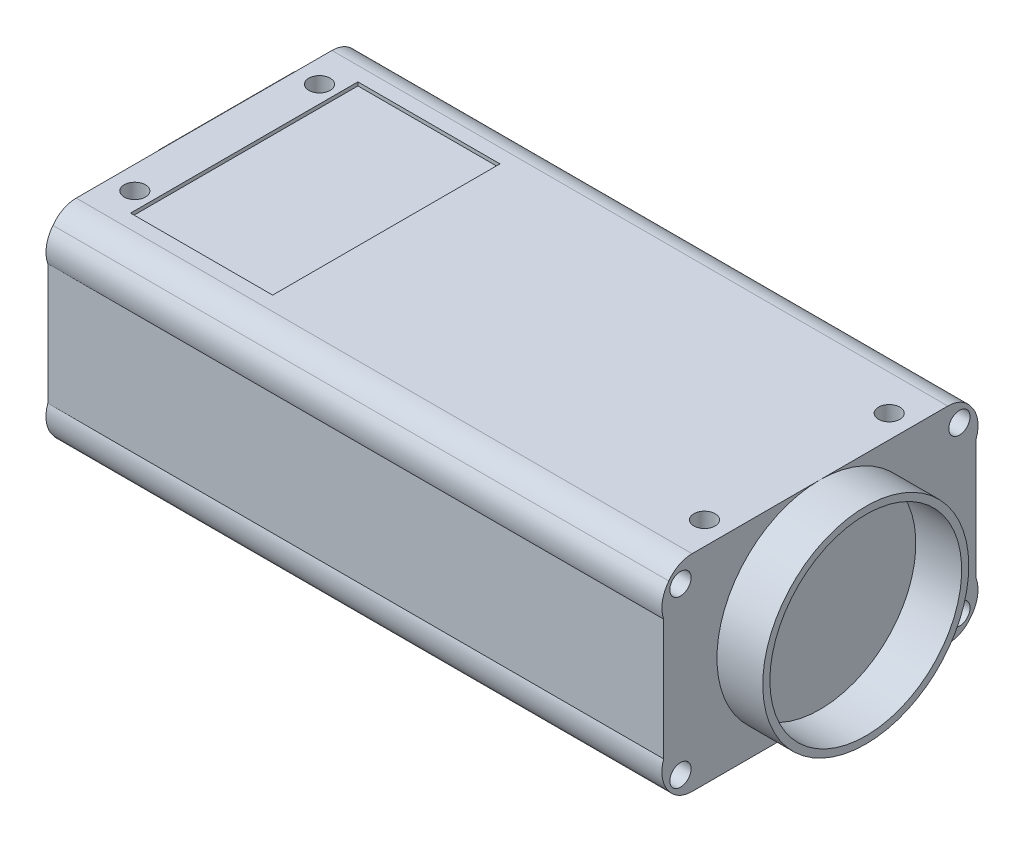
from build123d import *

# Parameters (mm, degrees)
SALIENTE_EXTRUIR2_DEPTH = 86.7
CROQUIS4_R              = 1.5
CORTAR_EXTRUIR1_DEPTH   = 4
CROQUIS5_R              = 14.5
CROQUIS5_R_2            = 13.5
SALIENTE_EXTRUIR3_DEPTH = 6.45
CROQUIS6_R              = 1.5
CORTAR_EXTRUIR2_DEPTH   = 3.5
CROQUIS8_W              = 20
CROQUIS8_H              = 32
CORTAR_EXTRUIR3_DEPTH   = 0.5
CROQUIS10_R             = 1
CORTAR_EXTRUIR6_DEPTH   = 4.5
CORTAR_EXTRUIR7_START   = -4.5
CROQUIS11_R             = 1.5
CORTAR_EXTRUIR7_DEPTH   = 4.5
CROQUIS12_W             = 19.288477202
CROQUIS12_H             = 16.6
SALIENTE_EXTRUIR4_DEPTH = 5.35
CROQUIS13_W             = 18
CROQUIS13_H             = 15.1
CORTAR_EXTRUIR8_DEPTH   = 4.35
CROQUIS14_W             = 10
CROQUIS14_H             = 5
CORTAR_EXTRUIR9_DEPTH   = 1
CROQUIS15_R             = 8
CORTAR_EXTRUIR10_DEPTH  = 3
CROQUIS16_R             = 7
CROQUIS16_R_2           = 6
SALIENTE_EXTRUIR5_DEPTH = 0.5
CROQUIS17_R             = 0.5
CORTAR_EXTRUIR12_DEPTH  = 1.5
CROQUIS18_R             = 1.5
CORTAR_EXTRUIR13_DEPTH  = 3.5


with BuildPart() as part:
    # Croquis3 → Saliente-Extruir2 (new body)
    with BuildSketch(Plane(origin=(0, 0, 0), x_dir=(0, 0, -1), z_dir=(1, 0, 0))):
        with BuildLine():
            Line((4, 0), (40, 0))
            ThreePointArc((40, 0), (41.842910618, 0.449833743), (43.271319545, 1.698159773))
            ThreePointArc((43.271319545, 1.698159773), (44.186191252, 3.744879364), (44, 5.979019946))
            Line((44, 5.979019946), (44, 23.020980054))
            ThreePointArc((44, 23.020980054), (44.186191252, 25.255120636), (43.271319545, 27.301840227))
            ThreePointArc((43.271319545, 27.301840227), (41.842910618, 28.550166257), (40, 29))
            Line((40, 29), (4, 29))
            ThreePointArc((4, 29), (2.157089382, 28.550166257), (0.728680455, 27.301840227))
            ThreePointArc((0.728680455, 27.301840227), (-0.186191252, 25.255120636), (0, 23.020980054))
            Line((0, 23.020980054), (0, 5.979019946))
            ThreePointArc((0, 5.979019946), (-0.186191252, 3.744879364), (0.728680455, 1.698159773))
            ThreePointArc((0.728680455, 1.698159773), (2.157089382, 0.449833743), (4, 0))
        make_face()
    extrude(amount=SALIENTE_EXTRUIR2_DEPTH)

    # Croquis4 → Cortar-Extruir1 (cut)
    with BuildSketch(Plane(origin=(86.7, 0, 0), x_dir=(0, 0, -1), z_dir=(1, 0, 0))):
        with Locations((2.364340227, 26.150920114)):
            Circle(CROQUIS4_R)
        with Locations(Location((41.635659773, 26.150920114, 0), (0, 0, 180))):
            Circle(CROQUIS4_R)
        with Locations((41.635659773, 2.849079886)):
            Circle(CROQUIS4_R)
        with Locations(Location((2.364340227, 2.849079886, 0), (0, 0, 180))):
            Circle(CROQUIS4_R)
    extrude(amount=-CORTAR_EXTRUIR1_DEPTH, mode=Mode.SUBTRACT)

    # Croquis5 → Saliente-Extruir3 (add)
    with BuildSketch(Plane(origin=(86.7, 0, 0), x_dir=(0, 0, -1), z_dir=(1, 0, 0))):
        with Locations(Location((22, 14.5, 0), (0, 0, 270))):
            Circle(CROQUIS5_R)
        with Locations(Location((22, 14.5, 0), (0, 0, 180))):
            Circle(CROQUIS5_R_2, mode=Mode.SUBTRACT)
    extrude(amount=SALIENTE_EXTRUIR3_DEPTH)

    # Croquis6 → Cortar-Extruir2 (cut)
    with BuildSketch(Plane(origin=(0, 29, 0), x_dir=(1, 0, 0), z_dir=(0, 1, 0))):
        with Locations(Location((83.45, 35, 0), (0, 0, 270))):
            Circle(CROQUIS6_R)
        with Locations(Location((83.45, 9, 0), (0, 0, 270))):
            Circle(CROQUIS6_R)
        with Locations(Location((3.25, 9, 0), (0, 0, 90))):
            Circle(CROQUIS6_R)
        with Locations(Location((3.25, 35, 0), (0, 0, 90))):
            Circle(CROQUIS6_R)
    extrude(amount=-CORTAR_EXTRUIR2_DEPTH, mode=Mode.SUBTRACT)

    # Croquis8 → Cortar-Extruir3 (cut)
    with BuildSketch(Plane(origin=(0, 29, 0), x_dir=(1, 0, 0), z_dir=(0, 1, 0))):
        with Locations((15.654947335, 22)):
            Rectangle(CROQUIS8_W, CROQUIS8_H)
    extrude(amount=-CORTAR_EXTRUIR3_DEPTH, mode=Mode.SUBTRACT)

    # Croquis10 → Cortar-Extruir6 (cut)
    with BuildSketch(Plane.ZY):
        with Locations((-30.5, 6.1)):
            Circle(CROQUIS10_R)
        with Locations((-30.5, 26.1)):
            Circle(CROQUIS10_R)
    extrude(amount=-CORTAR_EXTRUIR6_DEPTH, mode=Mode.SUBTRACT)

    # Croquis11 → Cortar-Extruir7 (cut)
    with BuildSketch(Plane.ZY.offset(CORTAR_EXTRUIR7_START)):
        with Locations((-41.635659773, 26.150920114)):
            Circle(CROQUIS11_R)
        with Locations(Location((-41.635659773, 2.849079886, 0), (0, 0, 180))):
            Circle(CROQUIS11_R)
        with Locations((-2.364340227, 2.849079886)):
            Circle(CROQUIS11_R)
        with Locations(Location((-2.364340227, 26.150920114, 0), (0, 0, 180))):
            Circle(CROQUIS11_R)
    extrude(amount=CORTAR_EXTRUIR7_DEPTH, mode=Mode.SUBTRACT)

    # Croquis12 → Saliente-Extruir4 (add)
    with BuildSketch(Plane.ZY):
        with Locations((-30.5, 15.4)):
            Rectangle(CROQUIS12_W, CROQUIS12_H)
    extrude(amount=SALIENTE_EXTRUIR4_DEPTH)

    # Croquis13 → Cortar-Extruir8 (cut)
    with BuildSketch(Plane.ZY.offset(5.35)):
        with Locations((-30.489294878, 15.4)):
            Rectangle(CROQUIS13_W, CROQUIS13_H)
    extrude(amount=-CORTAR_EXTRUIR8_DEPTH, mode=Mode.SUBTRACT)

    # Croquis14 → Cortar-Extruir9 (cut)
    with BuildSketch(Plane.ZY.offset(1)):
        with Locations((-30.5, 15.4)):
            Rectangle(CROQUIS14_W, CROQUIS14_H)
    extrude(amount=-CORTAR_EXTRUIR9_DEPTH, mode=Mode.SUBTRACT)

    # Croquis15 → Cortar-Extruir10 (cut)
    with BuildSketch(Plane.ZY):
        with Locations((-11.119013901, 15.6)):
            Circle(CROQUIS15_R)
    extrude(amount=-CORTAR_EXTRUIR10_DEPTH, mode=Mode.SUBTRACT)

    # Croquis16 → Saliente-Extruir5 (add)
    with BuildSketch(Plane.ZY.offset(-3)):
        with Locations((-11.119013901, 15.6)):
            Circle(CROQUIS16_R)
        with Locations((-11.119013901, 15.6)):
            Circle(CROQUIS16_R_2, mode=Mode.SUBTRACT)
    extrude(amount=SALIENTE_EXTRUIR5_DEPTH)

    # Croquis17 → Cortar-Extruir12 (cut)
    with BuildSketch(Plane.ZY.offset(-3)):
        with Locations((-11.025814876, 18.6)):
            Circle(CROQUIS17_R)
        with Locations((-9.119256477, 17.838226151)):
            Circle(CROQUIS17_R)
        with Locations((-8.148406801, 16.029161411)):
            Circle(CROQUIS17_R)
        with Locations((-8.567537202, 14.019287277)):
            Circle(CROQUIS17_R)
        with Locations((-10.180531906, 12.749046194)):
            Circle(CROQUIS17_R)
        with Locations((-12.232652766, 12.812798081)):
            Circle(CROQUIS17_R)
        with Locations((-13.763689624, 14.180712723)):
            Circle(CROQUIS17_R)
        with Locations((-14.057253319, 16.212727655)):
            Circle(CROQUIS17_R)
        with Locations((-12.975982135, 17.958040507)):
            Circle(CROQUIS17_R)
        with Locations((-11.985039305, 16.1)):
            Circle(CROQUIS17_R)
        with Locations((-10.252988497, 16.1)):
            Circle(CROQUIS17_R)
        with Locations((-11.119013901, 14.6)):
            Circle(CROQUIS17_R)
    extrude(amount=-CORTAR_EXTRUIR12_DEPTH, mode=Mode.SUBTRACT)

    # Croquis18 → Cortar-Extruir13 (cut)
    with BuildSketch(Plane.XZ):
        with Locations(Location((83.45, -8.377668185, 0), (0, 0, 270))):
            Circle(CROQUIS18_R)
        with Locations(Location((83.45, -34.377668185, 0), (0, 0, 270))):
            Circle(CROQUIS18_R)
        with Locations(Location((3.25, -34.377668185, 0), (0, 0, 90))):
            Circle(CROQUIS18_R)
        with Locations(Location((3.25, -8.377668185, 0), (0, 0, 90))):
            Circle(CROQUIS18_R)
    extrude(amount=-CORTAR_EXTRUIR13_DEPTH, mode=Mode.SUBTRACT)


solid = part.part
